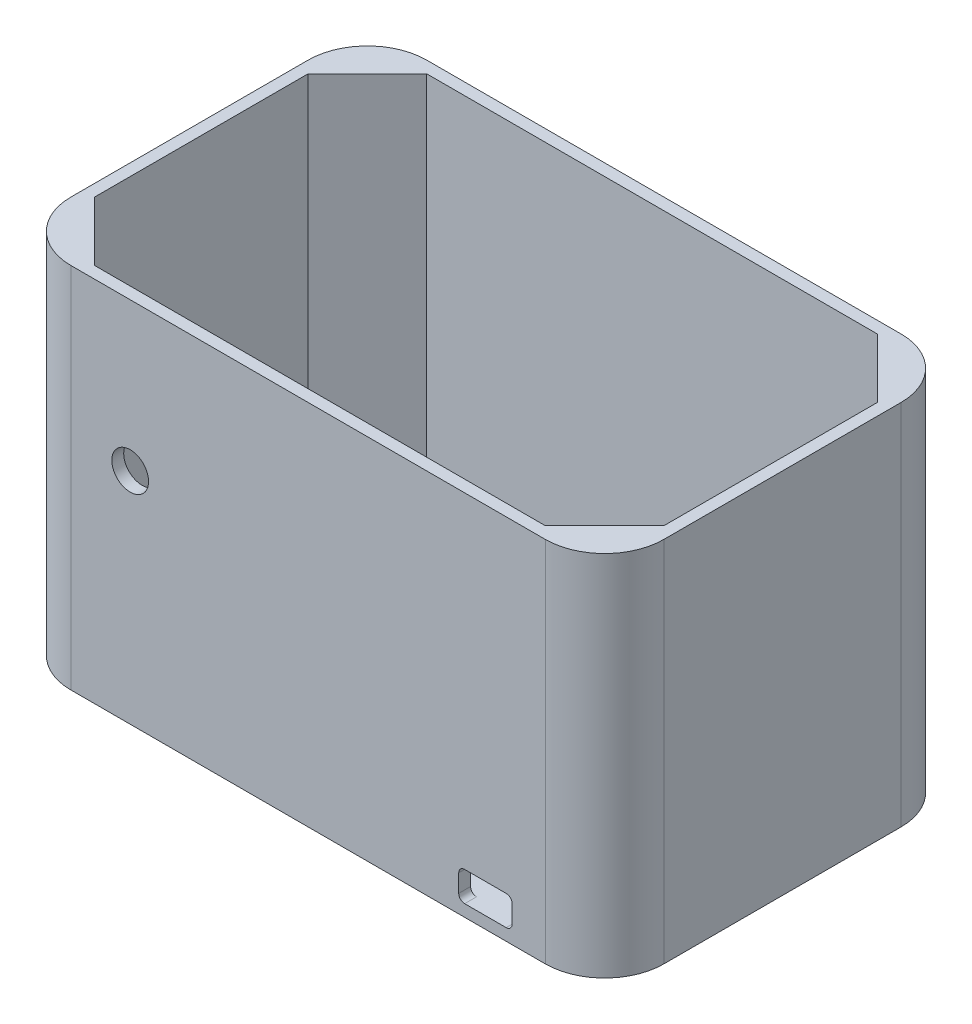
from build123d import *

# Parameters (mm, degrees)
Y_KSEKLIK_EKSTR_ZYON1_DEPTH = 2
Y_KSEKLIK_EKSTR_ZYON2_DEPTH = 60
IZIM3_R                     = 3.1
KES_EKSTR_ZYON1_DEPTH       = 10


with BuildPart() as part:
    # Çizim1 → Yükseklik-Ekstrüzyon1 (new body)
    with BuildSketch(Plane(origin=(0, 0, 0), x_dir=(1, 0, 0), z_dir=(0, 1, 0))):
        with BuildLine():
            Line((10, 0), (90, 0))
            ThreePointArc((90, 0), (97.071067812, 2.928932188), (100, 10))
            Line((100, 10), (100, 50))
            ThreePointArc((100, 50), (97.071067812, 57.071067812), (90, 60))
            Line((90, 60), (10, 60))
            ThreePointArc((10, 60), (2.928932188, 57.071067812), (0, 50))
            Line((0, 50), (0, 10))
            ThreePointArc((0, 10), (2.928932188, 2.928932188), (10, 0))
        make_face()
    extrude(amount=Y_KSEKLIK_EKSTR_ZYON1_DEPTH)

    # Çizim2 → Yükseklik-Ekstrüzyon2 (add)
    with BuildSketch(Plane(origin=(0, 2, 0), x_dir=(1, 0, 0), z_dir=(0, 1, 0))):
        with BuildLine():
            Line((100, 10), (100, 50))
            ThreePointArc((100, 50), (97.071067812, 57.071067812), (90, 60))
            Line((90, 60), (10, 60))
            ThreePointArc((10, 60), (2.928932188, 57.071067812), (0, 50))
            Line((0, 50), (0, 10))
            ThreePointArc((0, 10), (2.928932188, 2.928932188), (10, 0))
            Line((10, 0), (90, 0))
            ThreePointArc((90, 0), (97.071067812, 2.928932188), (100, 10))
        make_face()
        Polygon((12, 2), (88, 2), (98, 12), (98, 48), (88, 58), (12, 58), (2, 48), (2, 12), align=None, mode=Mode.SUBTRACT)
    extrude(amount=Y_KSEKLIK_EKSTR_ZYON2_DEPTH)

    # Çizim3 → Kes-Ekstrüzyon1 (cut)
    with BuildSketch(Plane.XY):
        with Locations((20, 37)):
            Circle(IZIM3_R)
        with BuildLine():
            Line((76.4, 2), (83.4, 2))
            ThreePointArc((83.4, 2), (84.107106781, 2.292893219), (84.4, 3))
            Line((84.4, 3), (84.4, 6))
            ThreePointArc((84.4, 6), (84.107106781, 6.707106781), (83.4, 7))
            Line((83.4, 7), (76.4, 7))
            ThreePointArc((76.4, 7), (75.692893219, 6.707106781), (75.4, 6))
            Line((75.4, 6), (75.4, 3))
            ThreePointArc((75.4, 3), (75.692893219, 2.292893219), (76.4, 2))
        make_face()
    extrude(amount=-KES_EKSTR_ZYON1_DEPTH, mode=Mode.SUBTRACT)


solid = part.part
